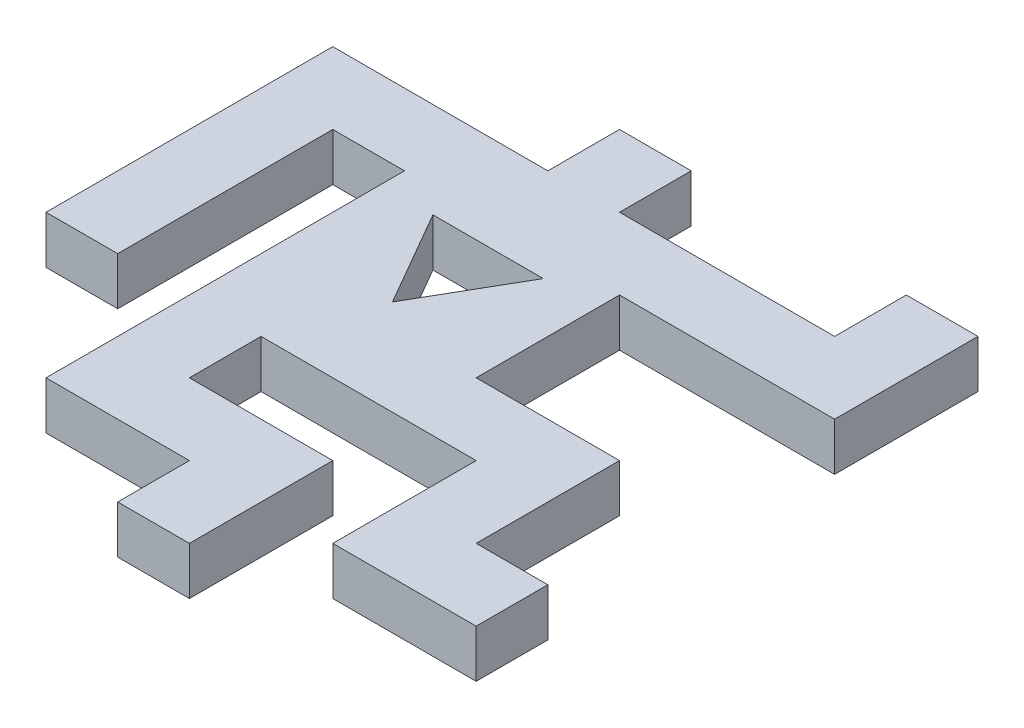
from build123d import *

# Parameters (mm, degrees)
SKETCH1_W           = 22.5
SKETCH1_H           = 30
SKETCH1_W_2         = 7.5
SKETCH1_H_2         = 7.5
BOSS_EXTRUDE1_DEPTH = 5
CUT_EXTRUDE1_DEPTH  = 51.698249477


with BuildPart() as part:
    # Sketch1 → Boss-Extrude1 (new body)
    with BuildSketch(Plane(origin=(0, 0, 0), x_dir=(1, 0, 0), z_dir=(0, 1, 0))):
        Polygon((-11.25, 7.5), (-11.25, 15), (-26.25, 15), (-26.25, -15), (-18.75, -15), (-18.75, 7.5), align=None)
        Rectangle(SKETCH1_W, SKETCH1_H)
        with Locations((0, 18.75)):
            Rectangle(SKETCH1_W_2, SKETCH1_H_2)
        Polygon((26.25, 15), (11.25, 15), (11.25, 7.5), (33.75, 7.5), (33.75, 22.5), (26.25, 22.5), align=None)
        Polygon((26.25, -7.5), (11.25, -7.5), (11.25, -15), (18.75, -15), (18.75, -30), (33.75, -30), (33.75, -22.5), (26.25, -22.5), align=None)
        Polygon((-3.75, -22.5), (-3.75, -15), (-11.25, -15), (-11.25, -30), (3.75, -30), (3.75, -37.5), (11.25, -37.5), (11.25, -22.5), align=None)
    extrude(amount=BOSS_EXTRUDE1_DEPTH)

    # Sketch2 → Cut-Extrude1 (cut, through all)
    with BuildSketch(Plane(origin=(0, 5, 0), x_dir=(1, 0, 0), z_dir=(0, 1, 0))):
        Polygon((-5.773502692, 5), (5.773502692, 5), (0, -5), align=None)
    extrude(amount=-CUT_EXTRUDE1_DEPTH, mode=Mode.SUBTRACT)


solid = part.part
